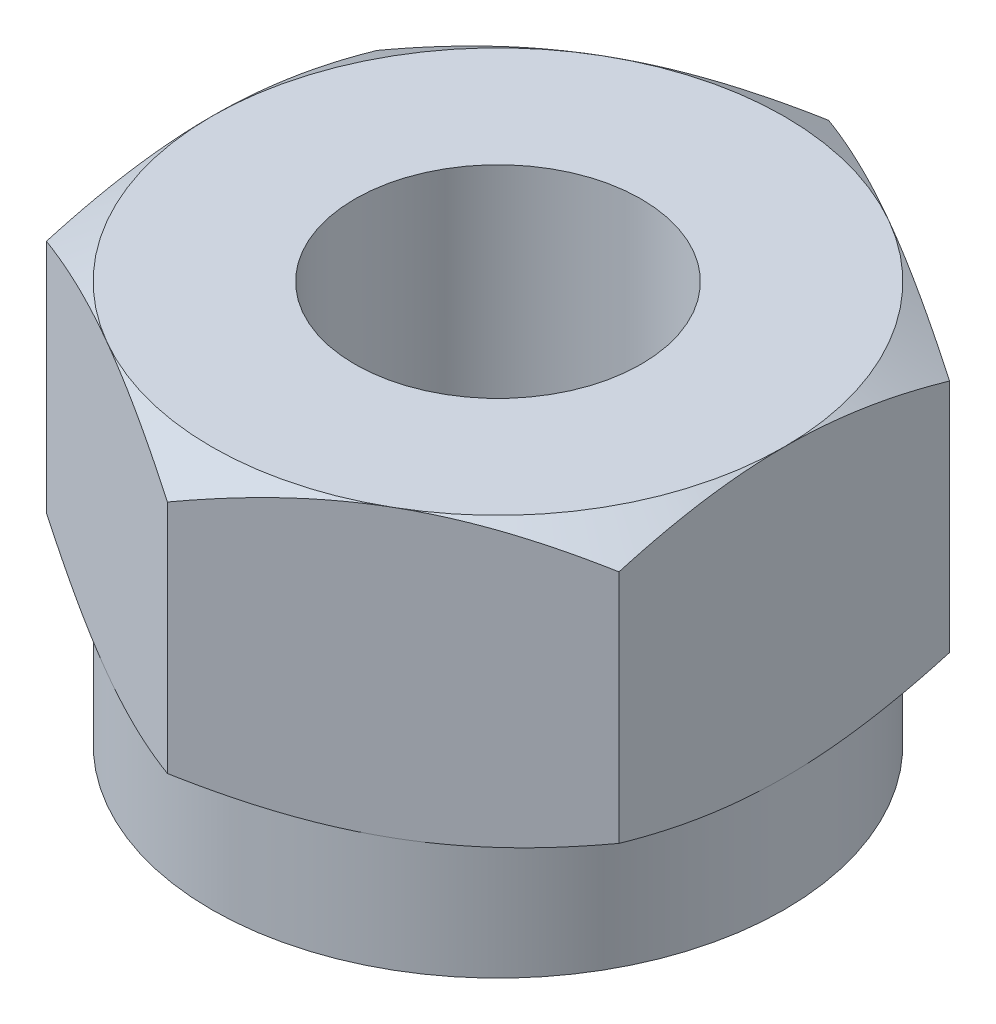
from build123d import *
from build123d.topology import SkipClean

# Parameters (mm, degrees)
SKETCH_1_R      = 1
EXTRUDE_2_DEPTH = 2
EXTRUDE_START   = 0.8
SKETCH_3_R      = 2
SKETCH_3_R_2    = 1
EXTRUDE_3_DEPTH = 0.8


with BuildPart() as part:
    # 草图1 → 凸台-拉伸2 (new body)
    with BuildSketch(Plane(origin=(0, 0, 0), x_dir=(1, 0, 0), z_dir=(0, 1, 0))):
        Polygon((2, 1.154700538), (0, 2.309401077), (-2, 1.154700538), (-2, -1.154700538), (0, -2.309401077), (2, -1.154700538), align=None)
        with Locations(Location((0, 0, 0), (0, 0, 270))):
            Circle(SKETCH_1_R, mode=Mode.SUBTRACT)
    extrude(amount=EXTRUDE_2_DEPTH)

    # 草图2 → 切除-旋转1 (revolve, cut)
    with BuildSketch(Plane.XY):
        Polygon((3.732050808, 1), (2, 2), (3.732050808, 2), align=None)
        Polygon((2, 0), (3.732050808, 1), (3.732050808, 0), align=None)
    revolve(axis=Axis((0, 1.981363764, 0), (0, 1, 0)), mode=Mode.SUBTRACT)

    # 草图3 → 凸台-拉伸3 (add)
    with SkipClean():  # the faces are left unmerged after this step: merging them gives an invalid solid
        with BuildSketch(Plane.XZ.offset(EXTRUDE_START)):
            with Locations(Location((0, 0, 0), (0, 0, 60))):
                Circle(SKETCH_3_R)
            with Locations(Location((0, 0, 0), (0, 0, 270))):
                Circle(SKETCH_3_R_2, mode=Mode.SUBTRACT)
        extrude(amount=-EXTRUDE_3_DEPTH)


solid = part.part
